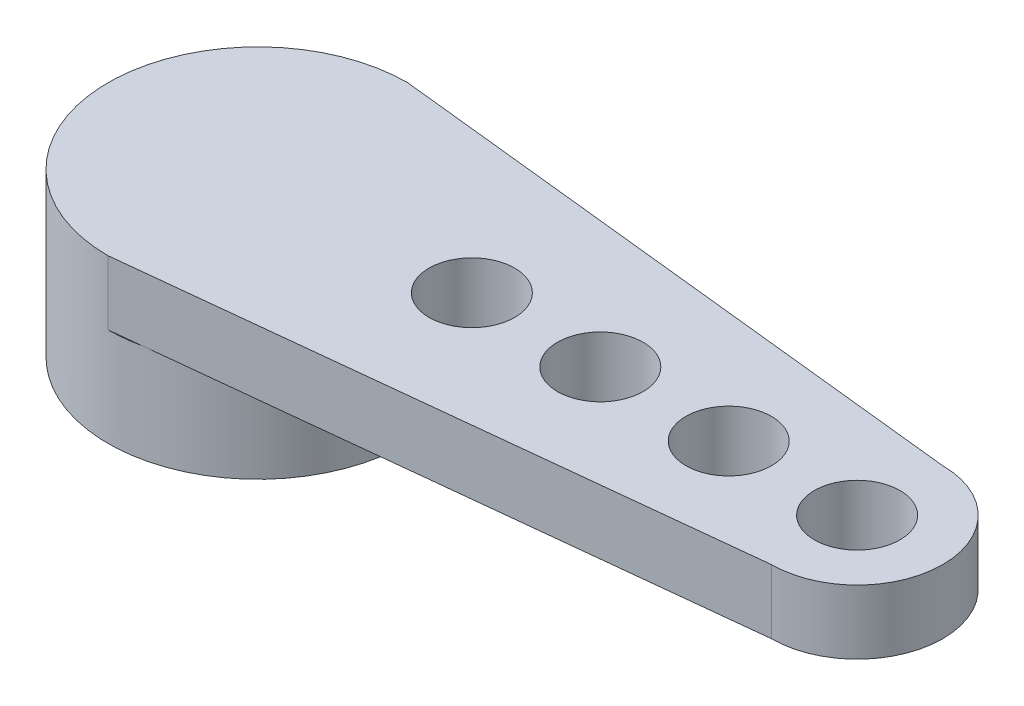
from build123d import *

# Parameters (mm, degrees)
BOSS_EXTRUDE1_DEPTH = 1.5
BOSS_EXTRUDE2_START = 2.3
SKETCH2_R           = 3.5
SKETCH2_R_2         = 2.4
BOSS_EXTRUDE2_DEPTH = 2.3
SKETCH3_R           = 1
CUT_EXTRUDE2_DEPTH  = 17.813387523


with BuildPart() as part:
    # Sketch1 → Boss-Extrude1 (new body)
    with BuildSketch(Plane(origin=(0, 0, 0), x_dir=(1, 0, 0), z_dir=(0, 1, 0))):
        with BuildLine():
            Line((0, 3.5), (14, 2))
            ThreePointArc((14, 2), (16, 0), (14, -2))
            Line((14, -2), (0, -3.5))
            ThreePointArc((0, -3.5), (-3.5, 0), (0, 3.5))
        make_face()
    extrude(amount=BOSS_EXTRUDE1_DEPTH)

    # Sketch2 → Boss-Extrude2 (add)
    with BuildSketch(Plane.XZ.offset(BOSS_EXTRUDE2_START)):
        with Locations(Location((0, 0, 0), (0, 0, 270))):
            Circle(SKETCH2_R)
        with Locations(Location((0, 0, 0), (0, 0, 270))):
            Circle(SKETCH2_R_2, mode=Mode.SUBTRACT)
    extrude(amount=-BOSS_EXTRUDE2_DEPTH)

    # Sketch3 → Cut-Extrude2 (cut, through all)
    with BuildSketch(Plane(origin=(0, 1.5, 0), x_dir=(1, 0, 0), z_dir=(0, 1, 0))):
        with Locations(Location((14, 0, 0), (0, 0, 270))):
            Circle(SKETCH3_R)
        with Locations(Location((11, 0, 0), (0, 0, 270))):
            Circle(SKETCH3_R)
        with Locations(Location((8, 0, 0), (0, 0, 270))):
            Circle(SKETCH3_R)
        with Locations(Location((5, 0, 0), (0, 0, 270))):
            Circle(SKETCH3_R)
    extrude(amount=-CUT_EXTRUDE2_DEPTH, mode=Mode.SUBTRACT)


solid = part.part
